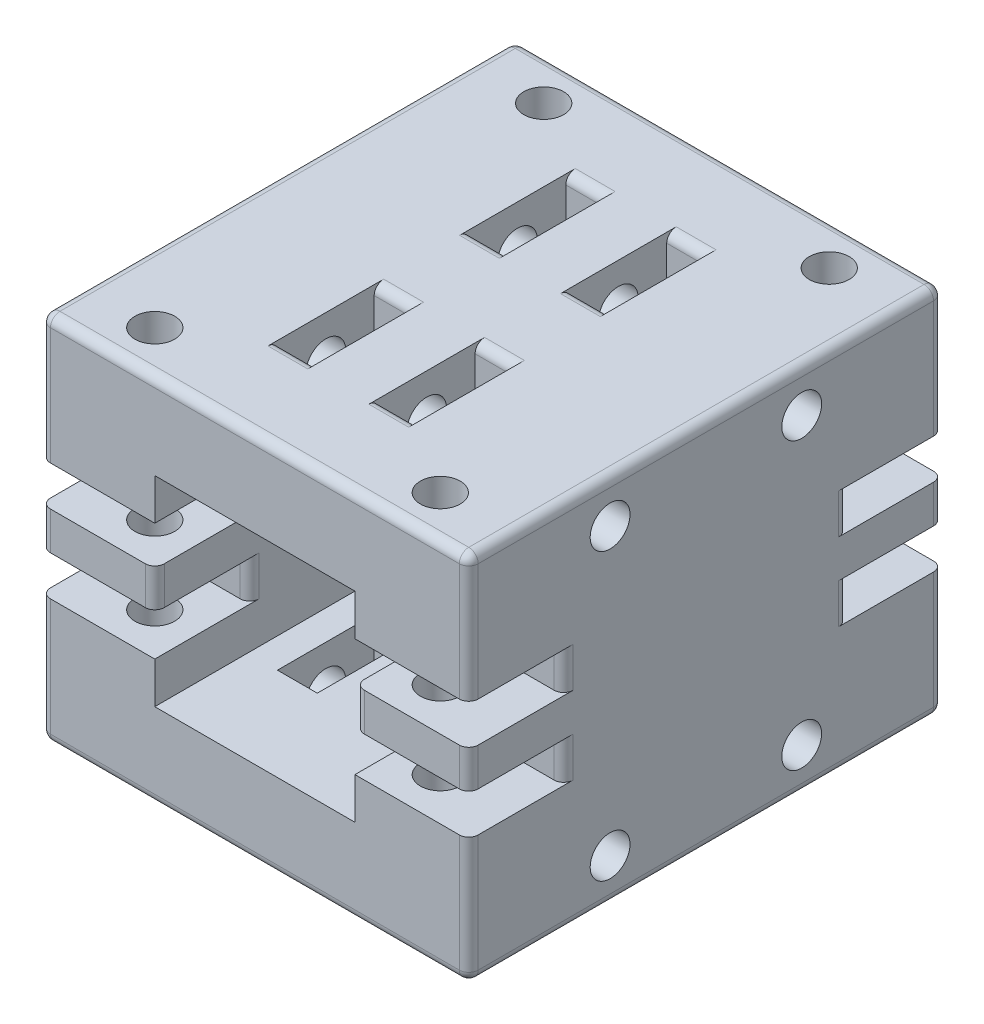
from build123d import *

# Parameters (mm, degrees)
SKETCH_1_W               = 45.1
SKETCH_1_H               = 39.1
SKETCH_1_W_2             = 21.1
SKETCH_1_H_2             = 21.1
EXTRUDE_1_DEPTH          = 50
SKETCH_2_W               = 12
SKETCH_2_H               = 4.2
CUT_EXTRUDE_1_DEPTH      = 10
CUT_EXTRUDE_2_DEPTH      = 30
CUT_EXTRUDE_2_DEPTH_BACK = 30
SKETCH_3_R               = 2.1
SKETCH_4_W               = 12
SKETCH_4_H               = 4.2
CUT_EXTRUDE_3_DEPTH      = 10
CUT_EXTRUDE_4_DEPTH      = 30
CUT_EXTRUDE_4_DEPTH_BACK = 30
SKETCH_5_R               = 2.1
SKETCH_6_W               = 4.2
SKETCH_6_H               = 10.2
CUT_EXTRUDE_5_DEPTH      = 80
CUT_EXTRUDE_6_DEPTH      = 80
CUT_EXTRUDE_6_DEPTH_BACK = 80
SKETCH_7_R               = 2.1
FILLET_1_R               = 1


with BuildPart() as part:
    # 草图1 → 凸台-拉伸1 (new body)
    with BuildSketch(Plane.XY):
        with Locations((10.55, 10.55)):
            Rectangle(SKETCH_1_W, SKETCH_1_H)
        with Locations((10.55, 10.55)):
            Rectangle(SKETCH_1_W_2, SKETCH_1_H_2, mode=Mode.SUBTRACT)
    extrude(amount=EXTRUDE_1_DEPTH)

    # 草图2 → 切除-拉伸1 (cut)
    with BuildSketch(Plane.XY.offset(50)):
        with Locations((27.1, 14.65)):
            Rectangle(SKETCH_2_W, SKETCH_2_H)
        with Locations((27.1, 6.45)):
            Rectangle(SKETCH_2_W, SKETCH_2_H)
        with Locations((-6, 6.45)):
            Rectangle(SKETCH_2_W, SKETCH_2_H)
        with Locations((-6, 14.65)):
            Rectangle(SKETCH_2_W, SKETCH_2_H)
    extrude(amount=-CUT_EXTRUDE_1_DEPTH, mode=Mode.SUBTRACT)

    # 草图3 → 切除-拉伸2 (cut, two sides: drawn at the far end of the back side and taken through both)
    with BuildSketch(Plane(origin=(0, 12.55, 0), x_dir=(1, 0, 0), z_dir=(0, 1, 0)).offset(-CUT_EXTRUDE_2_DEPTH_BACK)):
        with Locations(Location((25.6, -45.5, 0), (0, 0, 90))):
            Circle(SKETCH_3_R)
        with Locations(Location((-4.5, -45.5, 0), (0, 0, 90))):
            Circle(SKETCH_3_R)
    extrude(amount=CUT_EXTRUDE_2_DEPTH + CUT_EXTRUDE_2_DEPTH_BACK, mode=Mode.SUBTRACT)

    # 草图4 → 切除-拉伸3 (cut)
    with BuildSketch(Plane(origin=(0, 0, 0), x_dir=(-1, 0, 0), z_dir=(0, 0, -1))):
        with Locations((6, 6.45)):
            Rectangle(SKETCH_4_W, SKETCH_4_H)
        with Locations((6, 14.65)):
            Rectangle(SKETCH_4_W, SKETCH_4_H)
        with Locations((-27.1, 6.45)):
            Rectangle(SKETCH_4_W, SKETCH_4_H)
        with Locations((-27.1, 14.65)):
            Rectangle(SKETCH_4_W, SKETCH_4_H)
    extrude(amount=-CUT_EXTRUDE_3_DEPTH, mode=Mode.SUBTRACT)

    # 草图5 → 切除-拉伸4 (cut, two sides: drawn at the far end of the back side and taken through both)
    with BuildSketch(Plane(origin=(0, 12.55, 0), x_dir=(1, 0, 0), z_dir=(0, 1, 0)).offset(-CUT_EXTRUDE_4_DEPTH_BACK)):
        with Locations(Location((25.6, -4.5, 0), (0, 0, 90))):
            Circle(SKETCH_5_R)
        with Locations(Location((-4.5, -4.5, 0), (0, 0, 90))):
            Circle(SKETCH_5_R)
    extrude(amount=CUT_EXTRUDE_4_DEPTH + CUT_EXTRUDE_4_DEPTH_BACK, mode=Mode.SUBTRACT)

    # 草图6 → 切除-拉伸5 (cut)
    with BuildSketch(Plane(origin=(0, 30.1, 0), x_dir=(1, 0, 0), z_dir=(0, 1, 0))):
        with Locations((15.868916464, -14.9)):
            Rectangle(SKETCH_6_W, SKETCH_6_H)
        with Locations((5.231083536, -14.9)):
            Rectangle(SKETCH_6_W, SKETCH_6_H)
        with Locations((5.231083536, -35.1)):
            Rectangle(SKETCH_6_W, SKETCH_6_H)
        with Locations((15.868916464, -35.1)):
            Rectangle(SKETCH_6_W, SKETCH_6_H)
    extrude(amount=-CUT_EXTRUDE_5_DEPTH, mode=Mode.SUBTRACT)

    # 草图7 → 切除-拉伸6 (cut, two sides: drawn at the far end of the back side and taken through both)
    with BuildSketch(Plane(origin=(13.768916464, 0, 0), x_dir=(0, 0, -1), z_dir=(1, 0, 0)).offset(-CUT_EXTRUDE_6_DEPTH_BACK)):
        with Locations(Location((-35.1, 25.6, 0), (0, 0, 180))):
            Circle(SKETCH_7_R)
        with Locations(Location((-14.9, 25.6, 0), (0, 0, 180))):
            Circle(SKETCH_7_R)
        with Locations(Location((-14.9, -4.5, 0), (0, 0, 180))):
            Circle(SKETCH_7_R)
        with Locations(Location((-35.1, -4.5, 0), (0, 0, 180))):
            Circle(SKETCH_7_R)
    extrude(amount=CUT_EXTRUDE_6_DEPTH + CUT_EXTRUDE_6_DEPTH_BACK, mode=Mode.SUBTRACT)

    # 圆角1
    fillet_1_edges = [part.edges().sort_by_distance(p)[0] for p in [
        (21.1, 10.55, 0),
        (0, 10.55, 0),
        (33.1, 10.55, 0),
        (33.1, 23.425, 0),
        (-12, 10.55, 0),
        (-12, -2.325, 0),
        (33.1, -2.325, 50),
        (0, 14.65, 10),
        (-12, 14.65, 10),
        (21.1, 6.45, 10),
        (33.1, 6.45, 10),
        (21.1, 14.65, 10),
        (33.1, 14.65, 10),
        (0, 6.45, 10),
        (-12, 6.45, 10),
        (10.55, 30.1, 50),
        (15.868916464, -9, 30),
        (15.868916464, -9, 40.2),
        (15.868916464, 30.1, 40.2),
        (15.868916464, 30.1, 30),
        (5.231083536, -9, 40.2),
        (5.231083536, -9, 30),
        (5.231083536, 30.1, 40.2),
        (5.231083536, 30.1, 30),
        (5.231083536, -9, 20),
        (5.231083536, -9, 9.8),
        (5.231083536, 30.1, 9.8),
        (5.231083536, 30.1, 20),
        (15.868916464, -9, 9.8),
        (15.868916464, -9, 20),
        (15.868916464, 30.1, 20),
        (15.868916464, 30.1, 9.8),
        (21.1, 10.55, 50),
        (0, 10.55, 50),
        (33.1, 10.55, 50),
        (33.1, 23.425, 50),
        (-12, 10.55, 50),
        (-12, -2.325, 50),
        (0, 14.65, 40),
        (-12, 14.65, 40),
        (-12, 23.425, 50),
        (10.55, 30.1, 0),
        (33.1, -2.325, 0),
        (0, 6.45, 40),
        (-12, 6.45, 40),
        (10.55, -9, 0),
        (21.1, 6.45, 40),
        (33.1, 6.45, 40),
        (-12, 23.425, 0),
        (21.1, 14.65, 40),
        (33.1, 14.65, 40),
        (-12, 30.1, 25),
        (33.1, 30.1, 25),
        (33.1, -9, 25),
        (-12, -9, 25),
        (10.55, -9, 50),
    ]]
    fillet(fillet_1_edges, radius=FILLET_1_R)


solid = part.part
